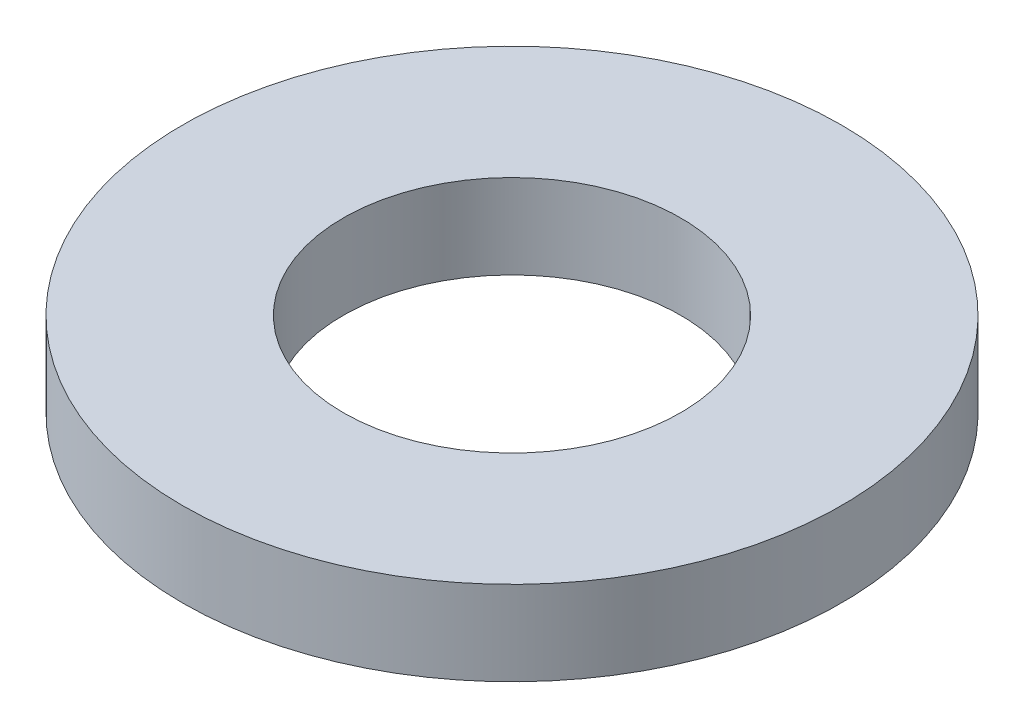
from build123d import *

# Parameters (mm, degrees)
SKETCH_1_R      = 6.25
SKETCH_1_R_2    = 3.2
EXTRUDE_1_DEPTH = 1.6


with BuildPart() as part:
    # Эскиз1 → Вытянуть1 (new body)
    with BuildSketch(Plane(origin=(0, 0, 0), x_dir=(1, 0, 0), z_dir=(0, 1, 0))):
        with Locations(Location((0, 0, 0), (0, 0, 270))):
            Circle(SKETCH_1_R)
        with Locations(Location((0, 0, 0), (0, 0, 270))):
            Circle(SKETCH_1_R_2, mode=Mode.SUBTRACT)
    extrude(amount=EXTRUDE_1_DEPTH)


solid = part.part
